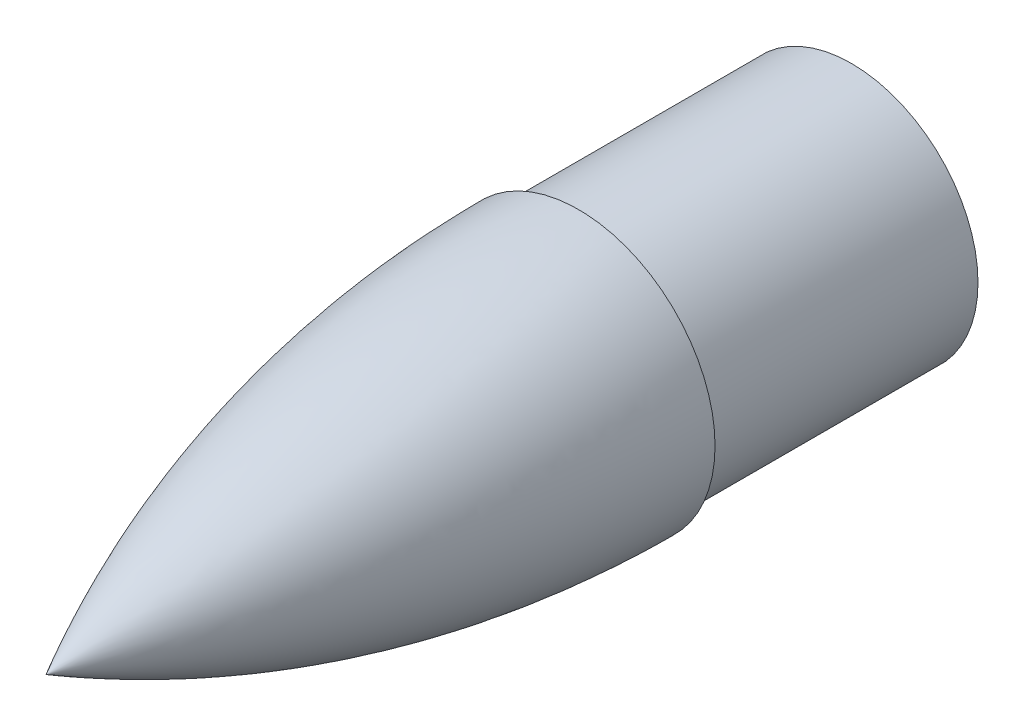
from build123d import *


with BuildPart() as part:
    # Croquis1 → Revolución2 (revolve)
    with BuildSketch(Plane(origin=(0, 0, 0), x_dir=(0, 0, -1), z_dir=(1, 0, 0)), mode=Mode.PRIVATE) as revoluci_n2_sk:
        with BuildLine():
            Line((0, 332.695121951), (0, 329.695121951))
            Line((0, 329.695121951), (82, 329.695121951))
            Line((82, 329.695121951), (82, 291.695121951))
            Line((82, 291.695121951), (77.477980573, 291.695121951))
            Line((77.477980573, 291.695121951), (77.477980573, 325.173102525))
            Line((77.477980573, 325.173102525), (-4.522019427, 325.173102525))
            Line((-4.522019427, 325.173102525), (-4.522019427, 328.141945751))
            ThreePointArc((-4.522019427, 328.141945751), (-79.561807658, 318.382637691), (-150.371343847, 291.695121951))
            Line((-150.371343847, 291.695121951), (-160, 291.695121951))
            ThreePointArc((-160, 291.695121951), (-82.584804898, 322.282165455), (0, 332.695121951))
        make_face()
    revolve(revoluci_n2_sk.sketch.rotate(Axis((0, 291.695121951, 160), (0, 0, 1)), 90), axis=Axis((0, 291.695121951, 160), (0, 0, 1)))


solid = part.part
